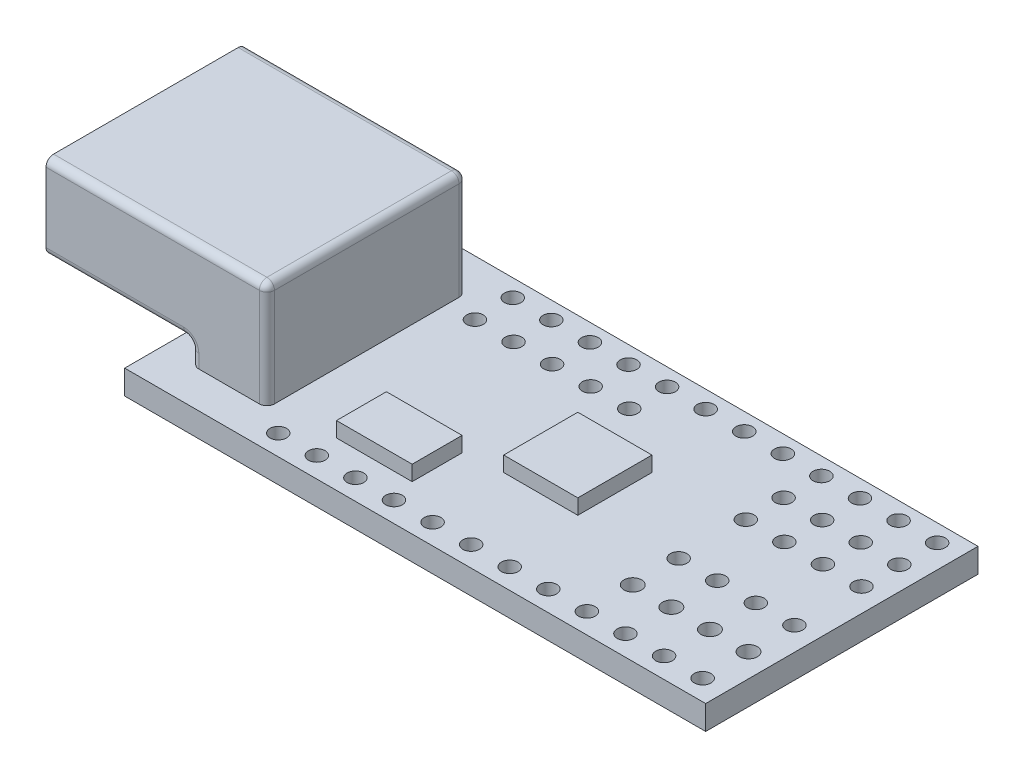
from build123d import *

# Parameters (mm, degrees)
ESQUISSE1_W             = 38.4
ESQUISSE1_H             = 18
ESQUISSE1_R             = 0.55
ESQUISSE1_R_2           = 0.582733778
BOSS_EXTRU_1_DEPTH      = 1.6
ESQUISSE2_W             = 5
ESQUISSE2_H             = 3.3
ESQUISSE2_W_2           = 4.9
ESQUISSE2_H_2           = 4.9
BOSS_EXTRU_2_DEPTH      = 1
ESQUISSE3_W             = 5
ESQUISSE3_H             = 13.2
BOSS_EXTRU_3_DEPTH      = 7
ESQUISSE4_W             = 13.2
ESQUISSE4_H             = 5.6
BOSS_EXTRU_4_DEPTH      = 9.6
CONG_2_R                = 0.5
ESQUISSE5_W             = 11.8
ESQUISSE5_H             = 4.2
ENL_V_MAT_EXTRU_1_DEPTH = 9.3
ESQUISSE6_W             = 9.8
ESQUISSE6_H             = 1.8
BOSS_EXTRU_5_DEPTH      = 8.5


with BuildPart() as part:
    # Esquisse1 → Boss.-Extru.1 (new body)
    with BuildSketch(Plane(origin=(0, 0, 0), x_dir=(1, 0, 0), z_dir=(0, 1, 0))):
        Rectangle(ESQUISSE1_W, ESQUISSE1_H)
        with Locations(Location((17.65, -7.65, 0), (0, 0, 270))):
            Circle(ESQUISSE1_R, mode=Mode.SUBTRACT)
        with Locations(Location((15.1, -7.65, 0), (0, 0, 270))):
            Circle(ESQUISSE1_R, mode=Mode.SUBTRACT)
        with Locations(Location((12.55, -7.65, 0), (0, 0, 270))):
            Circle(ESQUISSE1_R, mode=Mode.SUBTRACT)
        with Locations(Location((10, -7.65, 0), (0, 0, 270))):
            Circle(ESQUISSE1_R, mode=Mode.SUBTRACT)
        with Locations(Location((7.45, -7.65, 0), (0, 0, 270))):
            Circle(ESQUISSE1_R, mode=Mode.SUBTRACT)
        with Locations(Location((4.9, -7.65, 0), (0, 0, 270))):
            Circle(ESQUISSE1_R, mode=Mode.SUBTRACT)
        with Locations(Location((2.35, -7.65, 0), (0, 0, 270))):
            Circle(ESQUISSE1_R, mode=Mode.SUBTRACT)
        with Locations(Location((-0.2, -7.65, 0), (0, 0, 270))):
            Circle(ESQUISSE1_R, mode=Mode.SUBTRACT)
        with Locations(Location((-2.75, -7.65, 0), (0, 0, 270))):
            Circle(ESQUISSE1_R, mode=Mode.SUBTRACT)
        with Locations(Location((-5.3, -7.65, 0), (0, 0, 270))):
            Circle(ESQUISSE1_R, mode=Mode.SUBTRACT)
        with Locations(Location((-7.85, -7.65, 0), (0, 0, 270))):
            Circle(ESQUISSE1_R, mode=Mode.SUBTRACT)
        with Locations(Location((-10.4, -7.65, 0), (0, 0, 270))):
            Circle(ESQUISSE1_R, mode=Mode.SUBTRACT)
        with Locations(Location((17.65, 7.85, 0), (0, 0, 270))):
            Circle(ESQUISSE1_R, mode=Mode.SUBTRACT)
        with Locations(Location((15.1, 7.85, 0), (0, 0, 270))):
            Circle(ESQUISSE1_R, mode=Mode.SUBTRACT)
        with Locations(Location((12.55, 7.85, 0), (0, 0, 270))):
            Circle(ESQUISSE1_R, mode=Mode.SUBTRACT)
        with Locations(Location((10, 7.85, 0), (0, 0, 270))):
            Circle(ESQUISSE1_R, mode=Mode.SUBTRACT)
        with Locations(Location((7.45, 7.85, 0), (0, 0, 270))):
            Circle(ESQUISSE1_R, mode=Mode.SUBTRACT)
        with Locations(Location((4.9, 7.85, 0), (0, 0, 270))):
            Circle(ESQUISSE1_R, mode=Mode.SUBTRACT)
        with Locations(Location((2.35, 7.85, 0), (0, 0, 270))):
            Circle(ESQUISSE1_R, mode=Mode.SUBTRACT)
        with Locations(Location((-0.2, 7.85, 0), (0, 0, 270))):
            Circle(ESQUISSE1_R, mode=Mode.SUBTRACT)
        with Locations(Location((-2.75, 7.85, 0), (0, 0, 270))):
            Circle(ESQUISSE1_R, mode=Mode.SUBTRACT)
        with Locations(Location((-5.3, 7.85, 0), (0, 0, 270))):
            Circle(ESQUISSE1_R, mode=Mode.SUBTRACT)
        with Locations(Location((-7.85, 7.85, 0), (0, 0, 270))):
            Circle(ESQUISSE1_R, mode=Mode.SUBTRACT)
        with Locations(Location((-10.4, 7.85, 0), (0, 0, 270))):
            Circle(ESQUISSE1_R, mode=Mode.SUBTRACT)
        with Locations(Location((17.65, -4.617266222, 0), (0, 0, 270))):
            Circle(ESQUISSE1_R_2, mode=Mode.SUBTRACT)
        with Locations(Location((17.65, -1.584532444, 0), (0, 0, 270))):
            Circle(ESQUISSE1_R, mode=Mode.SUBTRACT)
        with Locations(Location((17.65, 5.35, 0), (0, 0, 270))):
            Circle(ESQUISSE1_R, mode=Mode.SUBTRACT)
        with Locations(Location((17.65, 2.85, 0), (0, 0, 270))):
            Circle(ESQUISSE1_R, mode=Mode.SUBTRACT)
        with Locations(Location((15.1, -4.617266222, 0), (0, 0, 270))):
            Circle(ESQUISSE1_R_2, mode=Mode.SUBTRACT)
        with Locations(Location((12.55, -4.617266222, 0), (0, 0, 270))):
            Circle(ESQUISSE1_R_2, mode=Mode.SUBTRACT)
        with Locations(Location((10, -4.617266222, 0), (0, 0, 270))):
            Circle(ESQUISSE1_R_2, mode=Mode.SUBTRACT)
        with Locations(Location((15.1, -1.584532444, 0), (0, 0, 270))):
            Circle(ESQUISSE1_R, mode=Mode.SUBTRACT)
        with Locations(Location((12.55, -1.584532444, 0), (0, 0, 270))):
            Circle(ESQUISSE1_R, mode=Mode.SUBTRACT)
        with Locations(Location((10, -1.584532444, 0), (0, 0, 270))):
            Circle(ESQUISSE1_R, mode=Mode.SUBTRACT)
        with Locations(Location((15.1, 5.35, 0), (0, 0, 270))):
            Circle(ESQUISSE1_R, mode=Mode.SUBTRACT)
        with Locations(Location((15.1, 2.85, 0), (0, 0, 270))):
            Circle(ESQUISSE1_R, mode=Mode.SUBTRACT)
        with Locations(Location((12.55, 5.35, 0), (0, 0, 270))):
            Circle(ESQUISSE1_R, mode=Mode.SUBTRACT)
        with Locations(Location((12.55, 2.85, 0), (0, 0, 270))):
            Circle(ESQUISSE1_R, mode=Mode.SUBTRACT)
        with Locations(Location((10, 5.35, 0), (0, 0, 270))):
            Circle(ESQUISSE1_R, mode=Mode.SUBTRACT)
        with Locations(Location((10, 2.85, 0), (0, 0, 270))):
            Circle(ESQUISSE1_R, mode=Mode.SUBTRACT)
        with Locations(Location((-10.4, 5.35, 0), (0, 0, 270))):
            Circle(ESQUISSE1_R, mode=Mode.SUBTRACT)
        with Locations(Location((-7.85, 5.35, 0), (0, 0, 270))):
            Circle(ESQUISSE1_R, mode=Mode.SUBTRACT)
        with Locations(Location((-5.3, 5.35, 0), (0, 0, 270))):
            Circle(ESQUISSE1_R, mode=Mode.SUBTRACT)
        with Locations(Location((-2.75, 5.35, 0), (0, 0, 270))):
            Circle(ESQUISSE1_R, mode=Mode.SUBTRACT)
        with Locations(Location((-0.2, 5.35, 0), (0, 0, 270))):
            Circle(ESQUISSE1_R, mode=Mode.SUBTRACT)
    extrude(amount=BOSS_EXTRU_1_DEPTH)

    # Esquisse2 → Boss.-Extru.2 (add)
    with BuildSketch(Plane(origin=(0, 1.6, 0), x_dir=(1, 0, 0), z_dir=(0, 1, 0))):
        with Locations((-5.7, -4.35)):
            Rectangle(ESQUISSE2_W, ESQUISSE2_H)
        with Locations((1.75, 0)):
            Rectangle(ESQUISSE2_W_2, ESQUISSE2_H_2)
    extrude(amount=BOSS_EXTRU_2_DEPTH)

    # Esquisse3 → Boss.-Extru.3 (add)
    with BuildSketch(Plane(origin=(0, 1.6, 0), x_dir=(1, 0, 0), z_dir=(0, 1, 0))):
        with Locations((-14.7, 0)):
            Rectangle(ESQUISSE3_W, ESQUISSE3_H)
    extrude(amount=BOSS_EXTRU_3_DEPTH)

    # Esquisse4 → Boss.-Extru.4 (add)
    with BuildSketch(Plane.ZY.offset(17.2)):
        with Locations((0, 5.8)):
            Rectangle(ESQUISSE4_W, ESQUISSE4_H)
    extrude(amount=BOSS_EXTRU_4_DEPTH)

    # Congé2
    cong_2_edges = [part.edges().sort_by_distance(p)[0] for p in [
        (-12.2, 5.1, 6.6),
        (-12.2, 5.1, -6.6),
        (-12.2, 8.6, 0),
        (-19.5, 8.6, -6.6),
        (-19.5, 8.6, 6.6),
        (-17.2, 2.3, 6.6),
        (-17.2, 2.3, -6.6),
        (-17.2, 3, 0),
        (-22, 3, -6.6),
        (-22, 3, 6.6),
    ]]
    fillet(cong_2_edges, radius=CONG_2_R)

    # Esquisse5 → Enlèv. mat.-Extru.1 (cut)
    with BuildSketch(Plane.ZY.offset(26.8)):
        with Locations((0, 5.8)):
            Rectangle(ESQUISSE5_W, ESQUISSE5_H)
    extrude(amount=-ENL_V_MAT_EXTRU_1_DEPTH, mode=Mode.SUBTRACT)

    # Esquisse6 → Boss.-Extru.5 (add)
    with BuildSketch(Plane.ZY.offset(17.5)):
        with Locations((0, 6.4)):
            Rectangle(ESQUISSE6_W, ESQUISSE6_H)
    extrude(amount=BOSS_EXTRU_5_DEPTH)


solid = part.part
